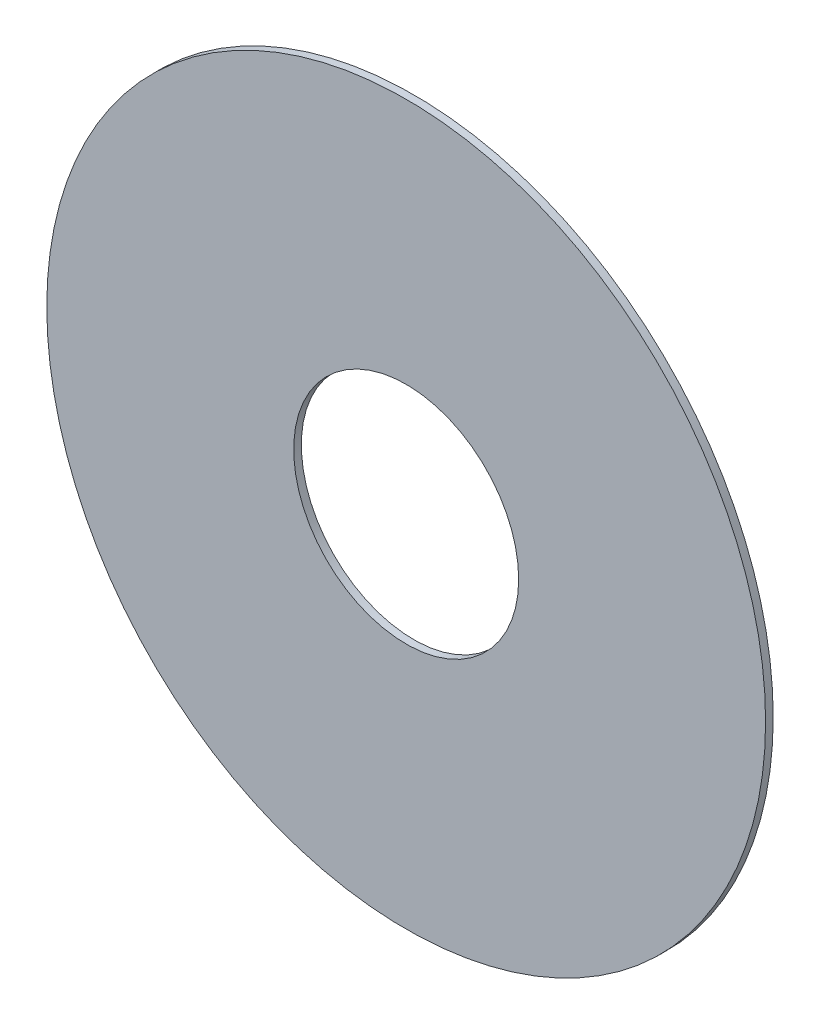
from build123d import *

# Parameters (mm, degrees)
PRINTED_GUARD_START = -47.5
SKETCH_1_R          = 94.246153846
SKETCH_1_R_2        = 29.5
PRINTED_GUARD_DEPTH = 2


with BuildPart() as part:
    # Эскиз1 → Printed_guard (new body)
    with BuildSketch(Plane.XY.offset(PRINTED_GUARD_START)):
        Circle(SKETCH_1_R)
        Circle(SKETCH_1_R_2, mode=Mode.SUBTRACT)
    extrude(amount=PRINTED_GUARD_DEPTH)


solid = part.part
